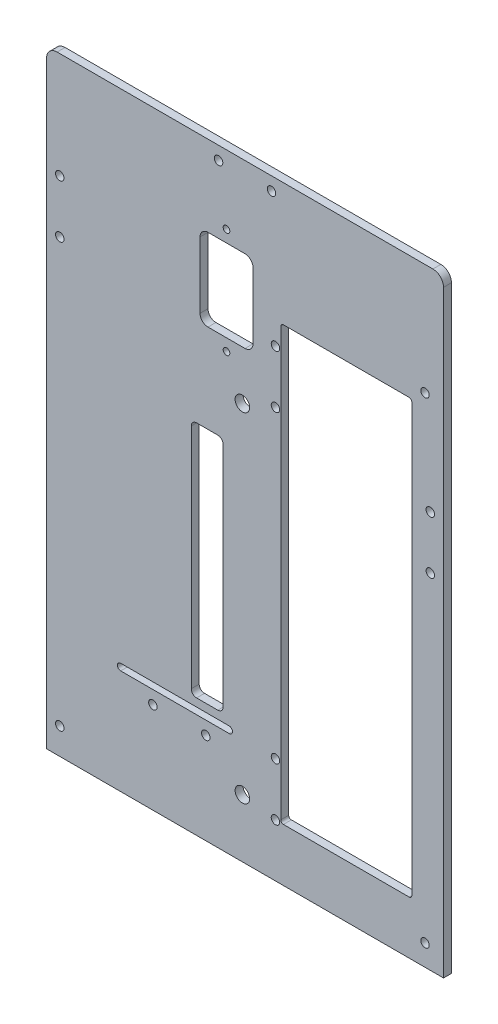
from build123d import *

# Parameters (mm, degrees)
SKETCH_1_W          = 150
SKETCH_1_H          = 230
EXTRUDE_1_DEPTH     = 3
SKETCH_2_R          = 1.6
CUT_EXTRUDE_1_DEPTH = 275.606991899
SKETCH_3_R          = 1.6
CUT_EXTRUDE_2_DEPTH = 275.606991899
CUT_EXTRUDE_3_REACH = 276.607
CUT_EXTRUDE_4_REACH = 276.607
SKETCH_5_W          = 49.5
SKETCH_5_H          = 163.5
FILLET_1_R          = 4
CUT_EXTRUDE_6_REACH = 276.607
SKETCH_7_R          = 1.25
FILLET_3_R          = 1
CUT_EXTRUDE_7_REACH = 276.607
SKETCH_8_W          = 20
SKETCH_8_H          = 31
FILLET_4_R          = 3
SKETCH_9_R          = 2.75
CUT_EXTRUDE_8_DEPTH = 275.606991899


with BuildPart() as part:
    # 草图1 → 凸台-拉伸1 (new body)
    with BuildSketch(Plane.XY):
        with Locations((75, 115)):
            Rectangle(SKETCH_1_W, SKETCH_1_H)
    extrude(amount=EXTRUDE_1_DEPTH)

    # 草图2 → 切除-拉伸1 (cut, through all)
    with BuildSketch(Plane.XY.offset(3)):
        with Locations((86.5, 20)):
            Circle(SKETCH_2_R)
        with Locations((86.5, 40)):
            Circle(SKETCH_2_R)
        with Locations((86.5, 155)):
            Circle(SKETCH_2_R)
        with Locations((86.5, 175)):
            Circle(SKETCH_2_R)
        with Locations((5, 10)):
            Circle(SKETCH_2_R)
        with Locations((143, 8)):
            Circle(SKETCH_2_R)
        with Locations((143, 188)):
            Circle(SKETCH_2_R)
        with Locations((5, 170)):
            Circle(SKETCH_2_R)
        with Locations((5, 190)):
            Circle(SKETCH_2_R)
        with Locations((65, 225)):
            Circle(SKETCH_2_R)
        with Locations((85, 225)):
            Circle(SKETCH_2_R)
        with Locations((145, 150)):
            Circle(SKETCH_2_R)
        with Locations((145, 130)):
            Circle(SKETCH_2_R)
    extrude(amount=-CUT_EXTRUDE_1_DEPTH, mode=Mode.SUBTRACT)

    # 草图3 → 切除-拉伸2 (cut, through all)
    with BuildSketch(Plane.XY.offset(3)):
        with Locations((40.19, 34.5)):
            Circle(SKETCH_3_R)
        with Locations(Location((60.19, 34.5, 0), (0, 0, 180))):
            Circle(SKETCH_3_R)
        with BuildLine():
            Line((28, 42), (69, 42))
            ThreePointArc((69, 42), (70.25, 40.75), (69, 39.5))
            Line((69, 39.5), (28, 39.5))
            ThreePointArc((28, 39.5), (26.75, 40.75), (28, 42))
        make_face()
    extrude(amount=-CUT_EXTRUDE_2_DEPTH, mode=Mode.SUBTRACT)

    # 草图4 → 切除-拉伸3 (cut, up to next)
    with BuildSketch(Plane.XY.offset(3), mode=Mode.PRIVATE) as cut_extrude_3_sk1:
        with BuildLine():
            Line((56.69, 135), (64.69, 135))
            ThreePointArc((64.69, 135), (66.104213562, 134.414213562), (66.69, 133))
            Line((66.69, 133), (66.69, 47))
            ThreePointArc((66.69, 47), (66.104213562, 45.585786438), (64.69, 45))
            Line((64.69, 45), (56.69, 45))
            ThreePointArc((56.69, 45), (55.275786438, 45.585786438), (54.69, 47))
            Line((54.69, 47), (54.69, 133))
            ThreePointArc((54.69, 133), (55.275786438, 134.414213562), (56.69, 135))
        make_face()
    cut_extrude_3_tool1 = extrude(cut_extrude_3_sk1.sketch, amount=-CUT_EXTRUDE_3_REACH, mode=Mode.PRIVATE) & part.part
    add(cut_extrude_3_tool1.solids().sort_by_distance((60.69, 90, 3))[0], mode=Mode.SUBTRACT)

    # 草图5 → 切除-拉伸4 (cut, up to next)
    with BuildSketch(Plane.XY.offset(3), mode=Mode.PRIVATE) as cut_extrude_4_sk1:
        with Locations((113.25, 101.75)):
            Rectangle(SKETCH_5_W, SKETCH_5_H)
    cut_extrude_4_tool1 = extrude(cut_extrude_4_sk1.sketch, amount=-CUT_EXTRUDE_4_REACH, mode=Mode.PRIVATE) & part.part
    add(cut_extrude_4_tool1.solids().sort_by_distance((113.25, 101.75, 3))[0], mode=Mode.SUBTRACT)

    # 圆角1
    fillet_1_edges = [part.edges().sort_by_distance(p)[0] for p in [
        (0, 230, 1.5),
        (150, 230, 1.5),
    ]]
    fillet(fillet_1_edges, radius=FILLET_1_R)

    # 草图7 → 切除-拉伸6 (cut, up to next)
    with BuildSketch(Plane.XY.offset(3), mode=Mode.PRIVATE) as cut_extrude_6_sk1:
        with Locations((68, 204)):
            Circle(SKETCH_7_R)
    cut_extrude_6_tool1 = extrude(cut_extrude_6_sk1.sketch, amount=-CUT_EXTRUDE_6_REACH, mode=Mode.PRIVATE) & part.part
    # 草图7 → 切除-拉伸6 (cut, up to next)
    with BuildSketch(Plane.XY.offset(3), mode=Mode.PRIVATE) as cut_extrude_6_sk2:
        with Locations((68, 164)):
            Circle(SKETCH_7_R)
    cut_extrude_6_tool2 = extrude(cut_extrude_6_sk2.sketch, amount=-CUT_EXTRUDE_6_REACH, mode=Mode.PRIVATE) & part.part
    # 草图7 → 切除-拉伸6 (cut, up to next)
    with BuildSketch(Plane.XY.offset(3), mode=Mode.PRIVATE) as cut_extrude_6_sk3:
        Polygon((77.775, 170.1), (77.775, 197.9), (64.620745433, 197.9), (58.225, 191.956783725), (58.225, 176.043216275), (64.620745433, 170.1), align=None)
    cut_extrude_6_tool3 = extrude(cut_extrude_6_sk3.sketch, amount=-CUT_EXTRUDE_6_REACH, mode=Mode.PRIVATE) & part.part
    add(cut_extrude_6_tool1.solids().sort_by_distance((68, 204, 3))[0], mode=Mode.SUBTRACT)
    add(cut_extrude_6_tool2.solids().sort_by_distance((68, 164, 3))[0], mode=Mode.SUBTRACT)
    add(cut_extrude_6_tool3.solids().sort_by_distance((68.574749, 184, 3))[0], mode=Mode.SUBTRACT)

    # 圆角3
    fillet_3_edges = [part.edges().sort_by_distance(p)[0] for p in [
        (138, 183.5, 1.5),
        (138, 20, 1.5),
        (88.5, 20, 1.5),
        (88.5, 183.5, 1.5),
    ]]
    fillet(fillet_3_edges, radius=FILLET_3_R)

    # 草图8 → 切除-拉伸7 (cut, up to next)
    with BuildSketch(Plane.XY.offset(3), mode=Mode.PRIVATE) as cut_extrude_7_sk1:
        with Locations((68, 184)):
            Rectangle(SKETCH_8_W, SKETCH_8_H)
    cut_extrude_7_tool1 = extrude(cut_extrude_7_sk1.sketch, amount=-CUT_EXTRUDE_7_REACH, mode=Mode.PRIVATE) & part.part
    add(cut_extrude_7_tool1.solids().sort_by_distance((68, 184, 3))[0], mode=Mode.SUBTRACT)

    # 圆角4
    fillet_4_edges = [part.edges().sort_by_distance(p)[0] for p in [
        (78, 199.5, 1.5),
        (78, 168.5, 1.5),
        (58, 168.5, 1.5),
        (58, 199.5, 1.5),
    ]]
    fillet(fillet_4_edges, radius=FILLET_4_R)

    # 草图9 → 切除-拉伸8 (cut, through all)
    with BuildSketch(Plane.XY.offset(3)):
        with Locations((74, 150)):
            Circle(SKETCH_9_R)
        with Locations((74, 22)):
            Circle(SKETCH_9_R)
    extrude(amount=-CUT_EXTRUDE_8_DEPTH, mode=Mode.SUBTRACT)


solid = part.part
